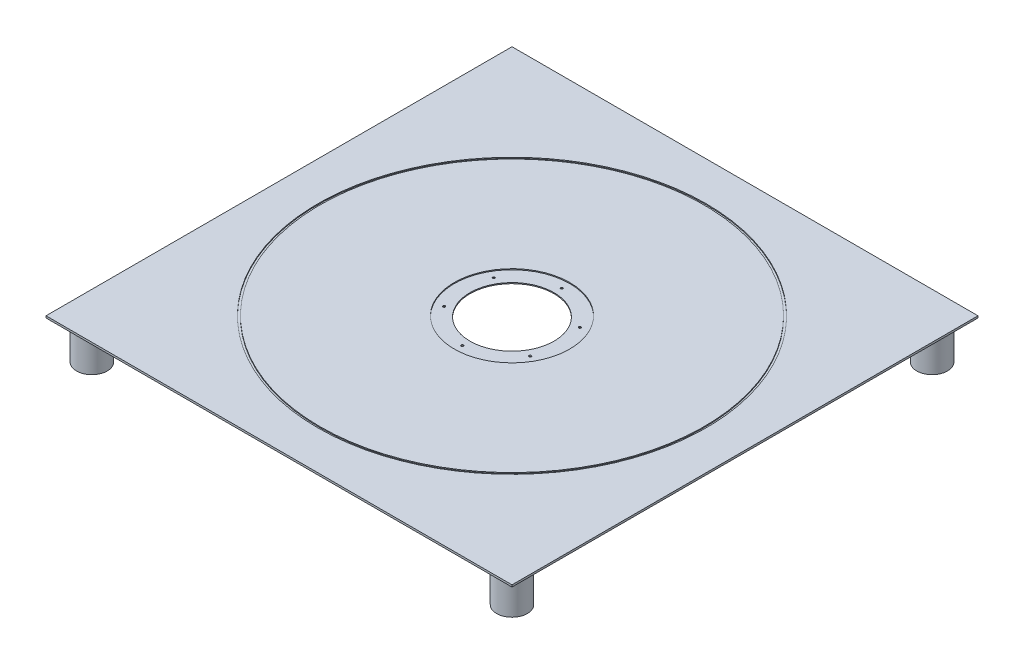
from build123d import *

# Parameters (mm, degrees)
SKETCH2_W                                  = 609.6
SKETCH2_H                                  = 609.6
BOSS_EXTRUDE1_DEPTH                        = 2.54
CUT_EXTRUDE1_DEPTH                         = 432.059777293
CUT_EXTRUDE1_DEPTH_BACK                    = 1.27
SKETCH5_R                                  = 75.5
CUT_EXTRUDE2_DEPTH                         = 432.054164694
CUT_EXTRUDE2_DEPTH_BACK                    = 432.054164694
SKETCH7_R                                  = 55
SKETCH12_R                                 = 20.123320675
BOSS_EXTRUDE2_DEPTH                        = 50
SKETCH13_R                                 = 1.5
CUT_EXTRUDE3_DEPTH                         = 10
CIRPATTERN2_COUNT                          = 6
MIRROR1_AT_THE_SECOND_PLANE_COPY_1_SKETC_R = 20.123320675
MIRROR1_AT_THE_SECOND_PLANE_COPY_1_DEPTH   = 50
SKETCH16_R                                 = 254
SKETCH16_R_2                               = 251.206
CUT_EXTRUDE6_DEPTH                         = 1.27


with BuildPart() as part:
    # Sketch2 → Boss-Extrude1 (new body)
    with BuildSketch(Plane(origin=(0, 0, 0), x_dir=(1, 0, 0), z_dir=(0, 1, 0))):
        Rectangle(SKETCH2_W, SKETCH2_H)
    extrude(amount=BOSS_EXTRUDE1_DEPTH)

    # Sketch5 → Cut-Extrude1 (cut, two sides: drawn at the far end of the back side and taken through both)
    with BuildSketch(Plane(origin=(0, 2.54, 0), x_dir=(1, 0, 0), z_dir=(0, 1, 0)).offset(-CUT_EXTRUDE1_DEPTH_BACK)):
        with Locations(Location((0, 0, 0), (0, 0, 90))):
            Circle(SKETCH5_R)
    extrude(amount=CUT_EXTRUDE1_DEPTH + CUT_EXTRUDE1_DEPTH_BACK, mode=Mode.SUBTRACT)

    # Sketch7 → Cut-Extrude2 (cut, two sides: drawn at the far end of the back side and taken through both)
    with BuildSketch(Plane(origin=(0, 1.27, 0), x_dir=(1, 0, 0), z_dir=(0, 1, 0)).offset(-CUT_EXTRUDE2_DEPTH_BACK)):
        with Locations(Location((0, 0, 0), (0, 0, 270))):
            Circle(SKETCH7_R)
    extrude(amount=CUT_EXTRUDE2_DEPTH + CUT_EXTRUDE2_DEPTH_BACK, mode=Mode.SUBTRACT)

    # Sketch12 → Boss-Extrude2 (add)
    with BuildSketch(Plane.XZ):
        with Locations(Location((-274.8, 274.8, 0), (0, 0, 270))):
            Circle(SKETCH12_R)
    boss_extrude2 = extrude(amount=BOSS_EXTRUDE2_DEPTH)

    # Sketch13 → Cut-Extrude3 (cut)
    with BuildSketch(Plane(origin=(0, 1.27, 0), x_dir=(1, 0, 0), z_dir=(0, 1, 0))):
        with Locations(Location((0, 65, 0), (0, 0, 270))):
            Circle(SKETCH13_R)
    cut_extrude3 = extrude(amount=-CUT_EXTRUDE3_DEPTH, mode=Mode.SUBTRACT)

    # CirPattern2: Cut-Extrude3 ×6 about axis
    cirpattern2_axis = Axis((0, 0, 0), (0, 1, 0))
    for i in range(1, CIRPATTERN2_COUNT):
        add(cut_extrude3.rotate(cirpattern2_axis, i * 360 / CIRPATTERN2_COUNT), mode=Mode.SUBTRACT)

    # Mirror1: Boss-Extrude2 across plane
    add(boss_extrude2.mirror(Plane.XY))

    # Mirror1 at the second plane: Boss-Extrude2 across plane
    add(boss_extrude2.mirror(Plane(origin=(0, 0, 0), x_dir=(0, 0, 1), z_dir=(1, 0, 0))))

    # Mirror1 at the second plane copy 1 sketc → Mirror1 at the second plane copy 1 (add)
    with BuildSketch(Plane(origin=(0, 0, 0), x_dir=(-1, 0, 0), z_dir=(0, -1, 0))):
        with Locations(Location((-274.8, 274.8, 0), (0, 0, 270))):
            Circle(MIRROR1_AT_THE_SECOND_PLANE_COPY_1_SKETC_R)
    extrude(amount=MIRROR1_AT_THE_SECOND_PLANE_COPY_1_DEPTH)

    # Sketch16 → Cut-Extrude6 (cut)
    with BuildSketch(Plane(origin=(0, 2.54, 0), x_dir=(1, 0, 0), z_dir=(0, 1, 0))):
        with Locations(Location((0, 0, 0), (0, 0, 270))):
            Circle(SKETCH16_R)
        with Locations(Location((0, 0, 0), (0, 0, 270))):
            Circle(SKETCH16_R_2, mode=Mode.SUBTRACT)
    extrude(amount=-CUT_EXTRUDE6_DEPTH, mode=Mode.SUBTRACT)


solid = part.part
